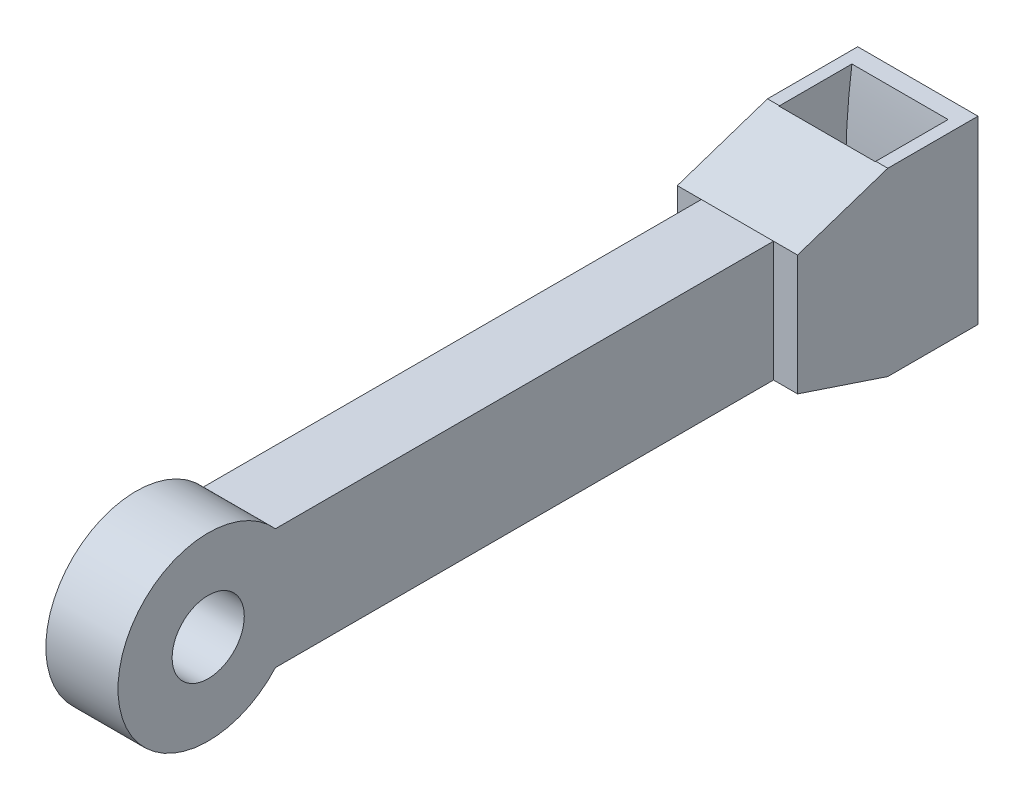
from build123d import *

# Parameters (mm, degrees)
SKETCH1_W               = 10
SKETCH1_H               = 15
BOSS_EXTRUDE1_DEPTH     = 15
CUT_EXTRUDE1_DEPTH      = 30
CUT_EXTRUDE3_DEPTH      = 4
CUT_EXTRUDE3_DEPTH_BACK = 4
CUT_EXTRUDE3_START      = -5
SKETCH13_W              = 10
SKETCH13_H              = 10
BOSS_EXTRUDE2_DEPTH     = 52
SKETCH14_R              = 7.5
SKETCH14_R_2            = 5
BOSS_EXTRUDE3_DEPTH     = 10
SKETCH16_R              = 3
CUT_EXTRUDE4_DEPTH      = 10
CUT_EXTRUDE5_DEPTH      = 10
CUT_EXTRUDE5_DEPTH_BACK = 20
SKETCH17_W              = 2
SKETCH17_H              = 56.751381774
SKETCH17_H_2            = 60.928957135


with BuildPart() as part:
    # Sketch1 → Boss-Extrude1 (new body)
    with BuildSketch(Plane.XY):
        with Locations((5, -7.5)):
            Rectangle(SKETCH1_W, SKETCH1_H)
    extrude(amount=BOSS_EXTRUDE1_DEPTH)

    # Sketch2 → Cut-Extrude1 (cut)
    with BuildSketch(Plane(origin=(10, 0, 0), x_dir=(0, 0, -1), z_dir=(1, 0, 0))):
        Polygon((-7.5, 0), (-15, -2.5), (-15, 0), align=None)
        Polygon((-7.5, -15), (-15, -12.5), (-15, -15), align=None)
    extrude(amount=-CUT_EXTRUDE1_DEPTH, mode=Mode.SUBTRACT)

    # Sketch12 → Cut-Extrude3 (cut, two sides: drawn at the far end of the back side and taken through both)
    with BuildSketch(Plane(origin=(10, 0, 0), x_dir=(0, 0, -1), z_dir=(1, 0, 0)).offset(CUT_EXTRUDE3_START - CUT_EXTRUDE3_DEPTH_BACK)):
        with BuildLine():
            ThreePointArc((7.921073494, 33.458565328), (-8, -7.5), (7.921073494, -48.458565328))
            ThreePointArc((7.921073494, -48.458565328), (12.159622245, -48.644856749), (12.345913666, -44.406307999))
            ThreePointArc((12.345913666, -44.406307999), (-2, -7.5), (12.345913666, 29.406307999))
            ThreePointArc((12.345913666, 29.406307999), (12.159622245, 33.644856749), (7.921073494, 33.458565328))
        make_face()
    extrude(amount=CUT_EXTRUDE3_DEPTH + CUT_EXTRUDE3_DEPTH_BACK, mode=Mode.SUBTRACT)

    # Sketch13 → Boss-Extrude2 (add)
    with BuildSketch(Plane.XY.offset(15)):
        with Locations((5, -7.5)):
            Rectangle(SKETCH13_W, SKETCH13_H)
    extrude(amount=BOSS_EXTRUDE2_DEPTH)

    # Sketch14 → Boss-Extrude3 (add)
    with BuildSketch(Plane.ZY):
        with Locations((62, -7.5)):
            Circle(SKETCH14_R)
        with Locations((62, -7.5)):
            Circle(SKETCH14_R_2, mode=Mode.SUBTRACT)
    extrude(amount=-BOSS_EXTRUDE3_DEPTH)

    # Sketch16 → Cut-Extrude4 (cut)
    with BuildSketch(Plane.ZY):
        with Locations(Location((62, -7.5, 0), (0, 0, 270))):
            Circle(SKETCH16_R)
    extrude(amount=-CUT_EXTRUDE4_DEPTH, mode=Mode.SUBTRACT)

    # Sketch17 → Cut-Extrude5 (cut, two sides: drawn at the far end of the back side and taken through both)
    with BuildSketch(Plane(origin=(0, -2.5, 0), x_dir=(1, 0, 0), z_dir=(0, 1, 0)).offset(-CUT_EXTRUDE5_DEPTH_BACK)):
        with Locations((1, -43.375690887)):
            Rectangle(SKETCH17_W, SKETCH17_H)
        with Locations((9, -45.464478568)):
            Rectangle(SKETCH17_W, SKETCH17_H_2)
    extrude(amount=CUT_EXTRUDE5_DEPTH + CUT_EXTRUDE5_DEPTH_BACK, mode=Mode.SUBTRACT)


solid = part.part
